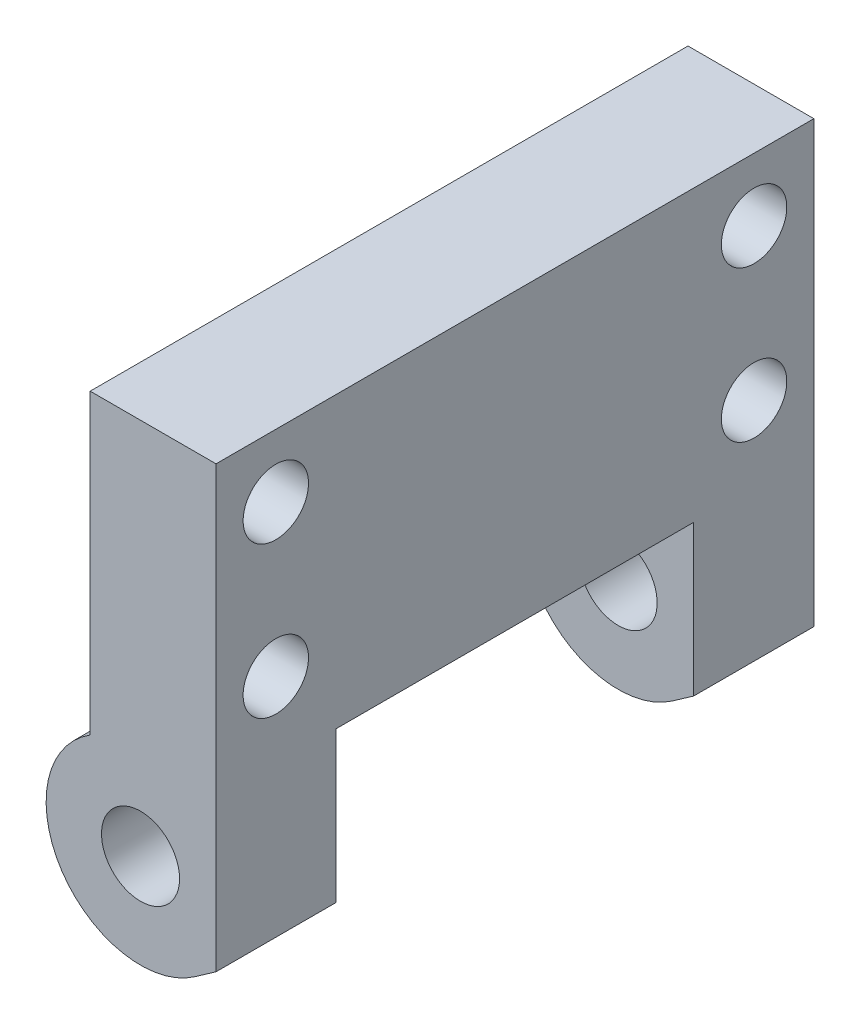
from build123d import *

# Parameters (mm, degrees)
SKETCH1_R           = 3.1
BOSS_EXTRUDE1_DEPTH = 47.5
SKETCH2_W           = 28.4
SKETCH2_H           = 18.032695685
CUT_EXTRUDE1_DEPTH  = 58.77975424
SKETCH3_R           = 2.6
CUT_EXTRUDE2_DEPTH  = 58.063561053


with BuildPart() as part:
    # Sketch1 → Boss-Extrude1 (new body)
    with BuildSketch(Plane.XY):
        with BuildLine():
            Line((-4, 6.34428877), (-4, 30))
            Line((-4, 30), (6, 30))
            Line((6, 30), (6, -4.954564186))
            Line((6, -4.954564186), (4.301823273, -6.143640332))
            ThreePointArc((4.301823273, -6.143640332), (-6.245787992, -4.152123837), (-4, 6.34428877))
        make_face()
        Circle(SKETCH1_R, mode=Mode.SUBTRACT)
    extrude(amount=BOSS_EXTRUDE1_DEPTH)

    # Sketch2 → Cut-Extrude1 (cut, through all)
    with BuildSketch(Plane(origin=(6, 0, 0), x_dir=(0, 0, -1), z_dir=(1, 0, 0))):
        with Locations((-23.75, -2.016347843)):
            Rectangle(SKETCH2_W, SKETCH2_H)
    extrude(amount=-CUT_EXTRUDE1_DEPTH, mode=Mode.SUBTRACT)

    # Sketch3 → Cut-Extrude2 (cut, through all)
    with BuildSketch(Plane.ZY.offset(4)):
        with Locations((4.75, 25)):
            Circle(SKETCH3_R)
        with Locations((4.75, 13)):
            Circle(SKETCH3_R)
        with Locations((42.75, 25)):
            Circle(SKETCH3_R)
        with Locations((42.75, 13)):
            Circle(SKETCH3_R)
    extrude(amount=-CUT_EXTRUDE2_DEPTH, mode=Mode.SUBTRACT)


solid = part.part
